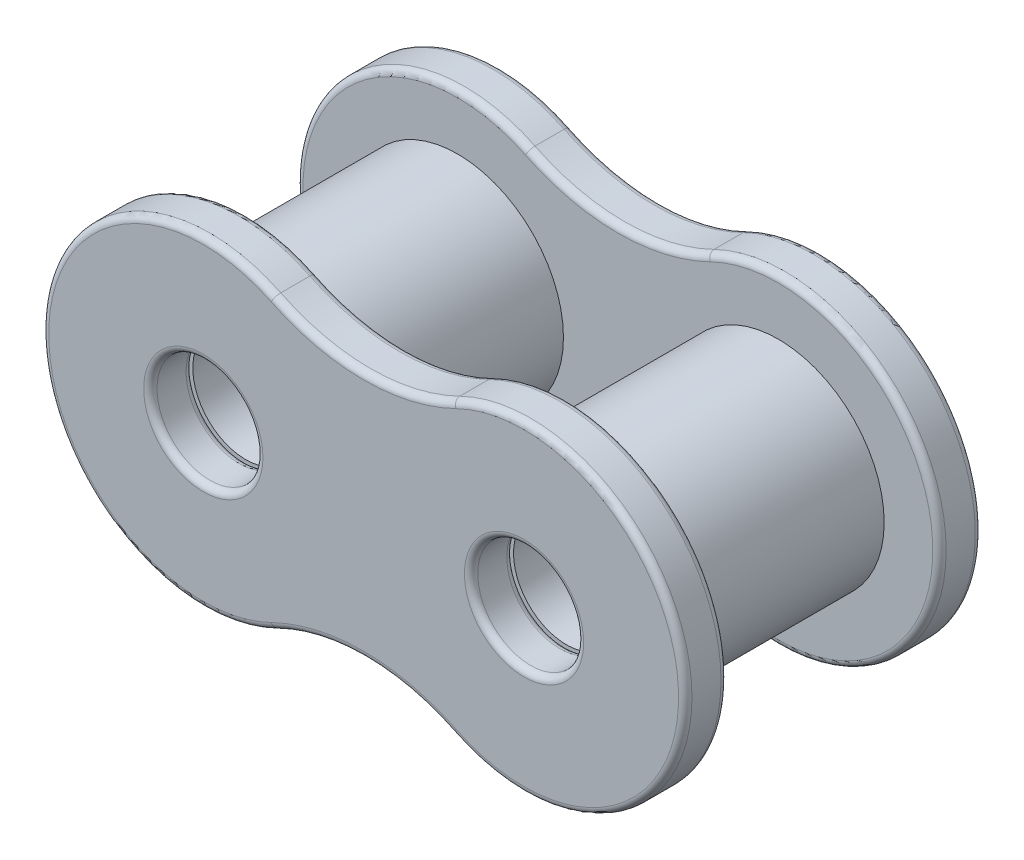
from build123d import *

# Parameters (mm, degrees)
ESQUISSE1_R        = 1.9812
BOSS_EXTRU_1_DEPTH = 1.5875
CONG_1_R           = 0.25
ESQUISSE3_R        = 3.9624
ESQUISSE3_R_2      = 1.9812
BOSS_EXTRU_2_DEPTH = 7.9248


with BuildPart() as part:
    # Esquisse1 → Boss.-Extru.1 (new body)
    with BuildSketch(Plane.XY):
        with BuildLine():
            ThreePointArc((-3.348887033, 5.418731981), (-12.0325, 0), (-3.348887033, -5.418731981))
            ThreePointArc((-3.348887033, -5.418731981), (0, -4.643419958), (3.348887033, -5.418731981))
            ThreePointArc((3.348887033, -5.418731981), (12.0325, 0), (3.348887033, 5.418731981))
            ThreePointArc((3.348887033, 5.418731981), (0, 4.643419958), (-3.348887033, 5.418731981))
        make_face()
        with Locations((-6, 0)):
            Circle(ESQUISSE1_R, mode=Mode.SUBTRACT)
        with Locations(Location((6, 0, 0), (0, 0, 180))):
            Circle(ESQUISSE1_R, mode=Mode.SUBTRACT)
    extrude(amount=BOSS_EXTRU_1_DEPTH)

    # Congé1
    cong_1_edges = [part.edges().sort_by_distance(p)[0] for p in [
        (-7.9812, 0, 0),
        (-7.9812, 0, 1.5875),
        (0, -4.643419958, 1.5875),
        (7.9812, 0, 0),
        (7.9812, 0, 1.5875),
        (12.0325, 0, 1.5875),
        (0, 4.643419958, 1.5875),
        (12.0325, 0, 0),
        (0, -4.643419958, 0),
        (-12.0325, 0, 0),
        (0, 4.643419958, 0),
        (-12.0325, 0, 1.5875),
    ]]
    fillet(cong_1_edges, radius=CONG_1_R)

    # Esquisse3 → Boss.-Extru.2 (add)
    with BuildSketch(Plane.XY.offset(1.5875)):
        with Locations((-6, 0)):
            Circle(ESQUISSE3_R)
        with Locations((-6, 0)):
            Circle(ESQUISSE3_R_2, mode=Mode.SUBTRACT)
    boss_extru_2 = extrude(amount=BOSS_EXTRU_2_DEPTH)

    # Symétrie1: Boss.-Extru.2 across plane
    add(boss_extru_2.mirror(Plane(origin=(0, 0, 0), x_dir=(0, 0, 1), z_dir=(1, 0, 0))))

    # Symétrie3: part across plane


with BuildPart() as part_1:
    add(part.part)
    add(part.part.mirror(Plane.XY.offset(5.5499)))


solid = part_1.part
